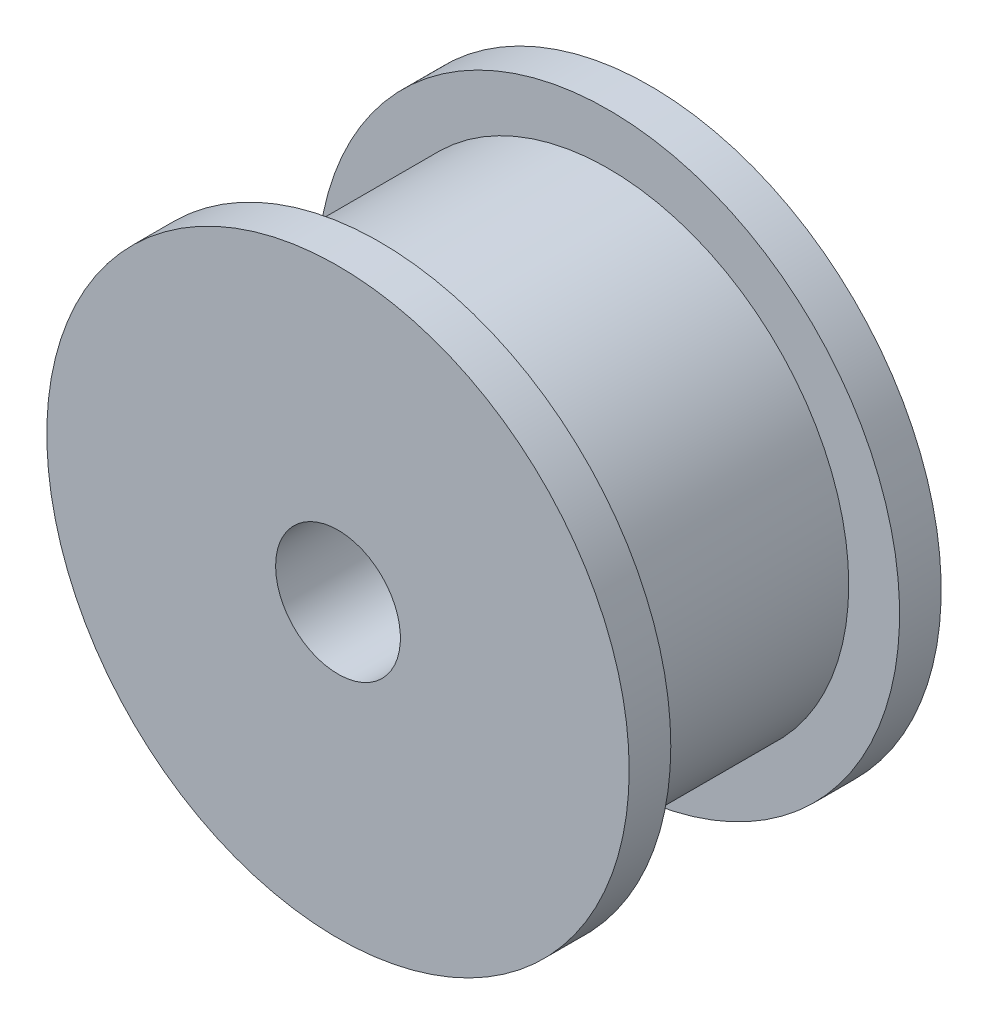
from build123d import *

# Parameters (mm, degrees)
SKETCH_1_R          = 11.555
EXTRUDE_1_DEPTH     = 11
SKETCH_2_R          = 14
EXTRUDE_2_DEPTH     = 2
EXTRUDE_START       = 2
SKETCH_3_R          = 14
EXTRUDE_3_DEPTH     = 2
SKETCH_4_R          = 3
CUT_EXTRUDE_1_DEPTH = 25.839484697


with BuildPart() as part:
    # 草图1 → 凸台-拉伸1 (new body)
    with BuildSketch(Plane.XY):
        Circle(SKETCH_1_R)
    extrude(amount=EXTRUDE_1_DEPTH)

    # 草图2 → 凸台-拉伸2 (add)
    with BuildSketch(Plane.XY.offset(11)):
        Circle(SKETCH_2_R)
    extrude(amount=EXTRUDE_2_DEPTH)

    # 草图3 → 凸台-拉伸3 (add)
    with BuildSketch(Plane(origin=(0, 0, 0), x_dir=(-1, 0, 0), z_dir=(0, 0, -1)).offset(EXTRUDE_START)):
        with Locations(Location((0, 0, 0), (0, 0, 180))):
            Circle(SKETCH_3_R)
    extrude(amount=-EXTRUDE_3_DEPTH)

    # 草图4 → 切除-拉伸1 (cut, through all)
    with BuildSketch(Plane(origin=(0, 0, -2), x_dir=(-1, 0, 0), z_dir=(0, 0, -1))):
        Circle(SKETCH_4_R)
    extrude(amount=-CUT_EXTRUDE_1_DEPTH, mode=Mode.SUBTRACT)


solid = part.part
